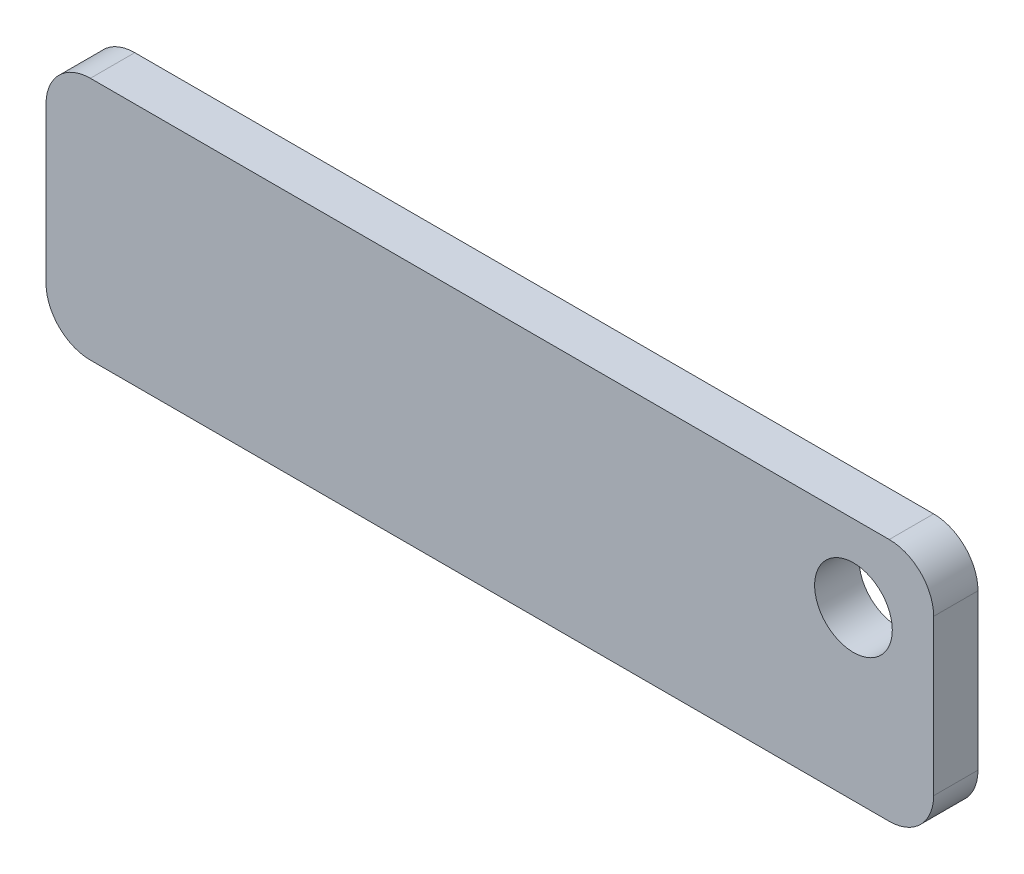
from build123d import *

# Parameters (mm, degrees)
BOSS_EXTRUDE2_DEPTH = 2
SKETCH3_R           = 1.75
CUT_EXTRUDE1_DEPTH  = 21.838665984


with BuildPart() as part:
    # Sketch2 → Boss-Extrude2 (new body)
    with BuildSketch(Plane.XY):
        with BuildLine():
            Line((-18, 5.5), (18, 5.5))
            ThreePointArc((18, 5.5), (19.414213562, 4.914213562), (20, 3.5))
            Line((20, 3.5), (20, -3.5))
            ThreePointArc((20, -3.5), (19.414213562, -4.914213562), (18, -5.5))
            Line((18, -5.5), (-18, -5.5))
            ThreePointArc((-18, -5.5), (-19.414213562, -4.914213562), (-20, -3.5))
            Line((-20, -3.5), (-20, 3.5))
            ThreePointArc((-20, 3.5), (-19.414213562, 4.914213562), (-18, 5.5))
        make_face()
    extrude(amount=BOSS_EXTRUDE2_DEPTH)

    # Sketch3 → Cut-Extrude1 (cut, through all)
    with BuildSketch(Plane.XY.offset(2)):
        with Locations((16.387938716, 2.034017624)):
            Circle(SKETCH3_R)
    extrude(amount=-CUT_EXTRUDE1_DEPTH, mode=Mode.SUBTRACT)


solid = part.part
